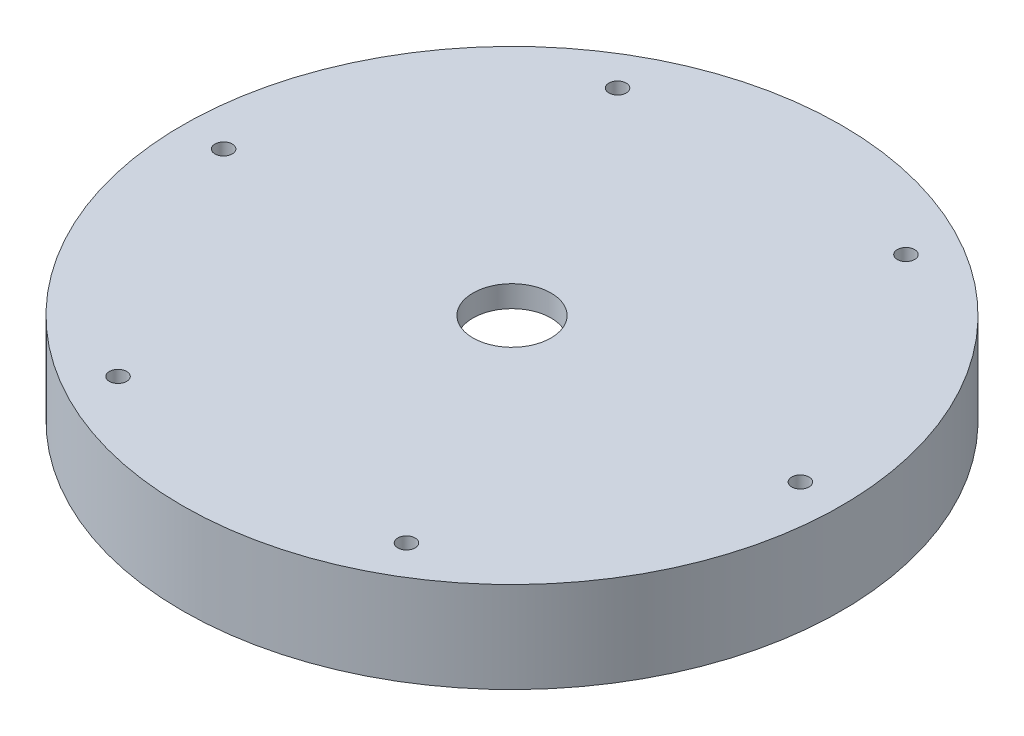
from build123d import *

# Parameters (mm, degrees)
SKETCH2_R          = 1
CUT_EXTRUDE1_DEPTH = 56.061468492


with BuildPart() as part:
    # Sketch1 → Revolve1 (revolve)
    with BuildSketch(Plane.XY, mode=Mode.PRIVATE) as revolve1_sk:
        Polygon((-4.5, 0), (-38.0375, 0), (-38.0375, -10.5), (-35.0375, -10.5), (-35.0375, -11.75), (-20, -11.75), (-20, -2.5), (-4.5, -2.5), align=None)
    revolve(revolve1_sk.sketch.rotate(Axis((0, 38.708668819, 0), (0, -1, 0)), 270), axis=Axis((0, 38.708668819, 0), (0, -1, 0)))

    # Sketch2 → Cut-Extrude1 (cut, through all)
    with BuildSketch(Plane.XZ.offset(11.75)):
        with Locations(Location((-33.2875, 0, 0), (0, 0, 270))):
            Circle(SKETCH2_R)
        with Locations(Location((-16.64375, 28.827820628, 0), (0, 0, 270))):
            Circle(SKETCH2_R)
        with Locations(Location((16.64375, 28.827820628, 0), (0, 0, 270))):
            Circle(SKETCH2_R)
        with Locations(Location((33.2875, 0, 0), (0, 0, 270))):
            Circle(SKETCH2_R)
        with Locations(Location((16.64375, -28.827820628, 0), (0, 0, 270))):
            Circle(SKETCH2_R)
        with Locations(Location((-16.64375, -28.827820628, 0), (0, 0, 270))):
            Circle(SKETCH2_R)
    extrude(amount=-CUT_EXTRUDE1_DEPTH, mode=Mode.SUBTRACT)


solid = part.part
